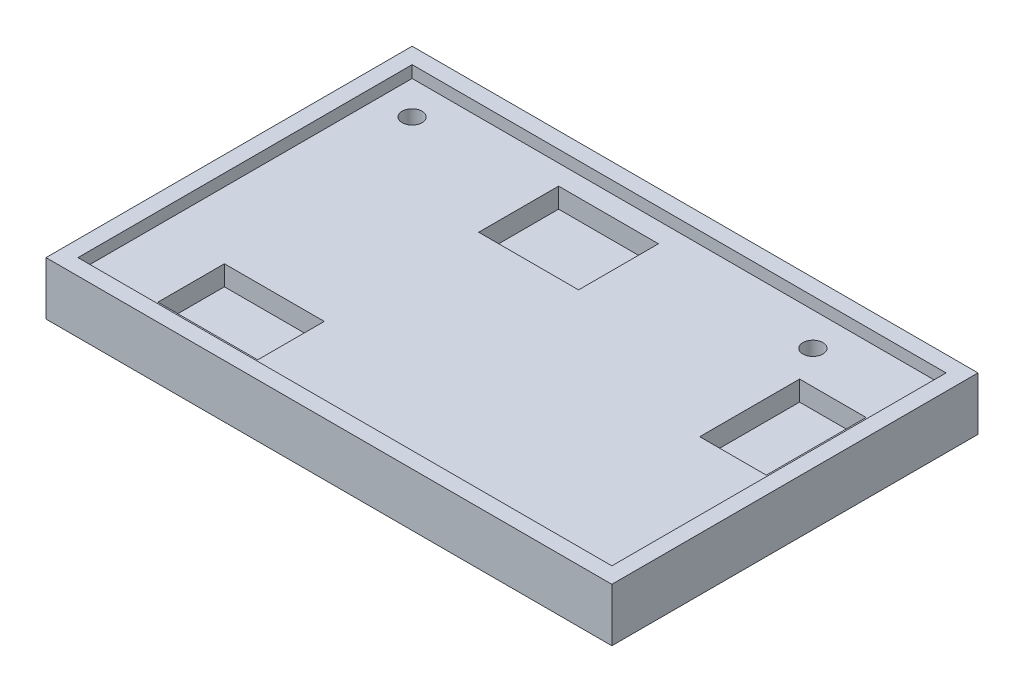
from build123d import *

# Parameters (mm, degrees)
SKETCH_2_W          = 85
SKETCH_2_H          = 55
EXTRUDE_3_DEPTH     = 8
SKETCH_5_W          = 80.2
SKETCH_5_H          = 50.2
CUT_EXTRUDE_1_DEPTH = 1.8
SKETCH_7_R          = 1.5
CUT_EXTRUDE_4_DEPTH = 2.2
SKETCH_8_W          = 15
SKETCH_8_H          = 10
SKETCH_8_W_2        = 10
SKETCH_8_H_2        = 15
SKETCH_8_H_3        = 12
CUT_EXTRUDE_6_DEPTH = 3


with BuildPart() as part:
    # 草图2 → 凸台-拉伸3 (new body)
    with BuildSketch(Plane(origin=(0, 0, 0), x_dir=(1, 0, 0), z_dir=(0, 1, 0))):
        with Locations((42.5, 27.5)):
            Rectangle(SKETCH_2_W, SKETCH_2_H)
    extrude(amount=EXTRUDE_3_DEPTH)

    # 草图5 → 切除-拉伸1 (cut)
    with BuildSketch(Plane(origin=(0, 8, 0), x_dir=(1, 0, 0), z_dir=(0, 1, 0))):
        with Locations((42.5, 27.5)):
            Rectangle(SKETCH_5_W, SKETCH_5_H)
    extrude(amount=-CUT_EXTRUDE_1_DEPTH, mode=Mode.SUBTRACT)

    # 草图7 → 切除-拉伸4 (cut)
    with BuildSketch(Plane(origin=(0, 6.2, 0), x_dir=(1, 0, 0), z_dir=(0, 1, 0))):
        with Locations(Location((7.4, 47.6, 0), (0, 0, 270))):
            Circle(SKETCH_7_R)
        with Locations(Location((67.6, 47.6, 0), (0, 0, 90))):
            Circle(SKETCH_7_R)
        with Locations((7.4, -2.6)):
            Circle(SKETCH_7_R)
        with Locations((67.6, -2.6)):
            Circle(SKETCH_7_R)
    extrude(amount=-CUT_EXTRUDE_4_DEPTH, mode=Mode.SUBTRACT)

    # 草图8 → 切除-拉伸6 (cut)
    with BuildSketch(Plane(origin=(0, 6.2, 0), x_dir=(1, 0, 0), z_dir=(0, 1, 0))):
        with Locations((19.9, 9.4)):
            Rectangle(SKETCH_8_W, SKETCH_8_H)
        with Locations((75.6, 35.1)):
            Rectangle(SKETCH_8_W_2, SKETCH_8_H_2)
        with Locations((34.9, 43.6)):
            Rectangle(SKETCH_8_W, SKETCH_8_H_3)
    extrude(amount=-CUT_EXTRUDE_6_DEPTH, mode=Mode.SUBTRACT)


solid = part.part
